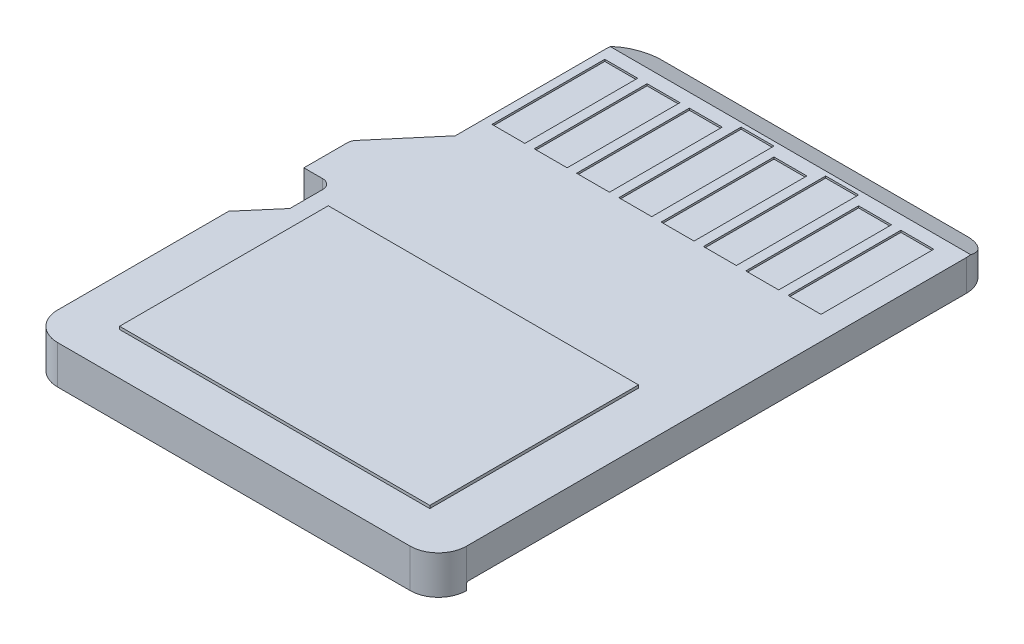
from build123d import *

# Parameters (mm, degrees)
BOSS_EXTRUDE1_DEPTH = 9.753600003
SKETCH2_W           = 8.686799997
SKETCH2_H           = 0.8382
BOSS_EXTRUDE2_DEPTH = 1.295399997
BOSS_EXTRUDE3_DEPTH = 0.2032
SKETCH4_W           = 0.762
SKETCH4_H           = 2.032
CUT_EXTRUDE1_DEPTH  = 19.680648463
SKETCH5_W           = 8.382
SKETCH5_H           = 5.6388
BOSS_EXTRUDE4_DEPTH = 0.0762
SKETCH6_W           = 0.889000002
SKETCH6_H           = 3.048
CUT_EXTRUDE2_DEPTH  = 0.0508
SKETCH7_W           = 0.889
SKETCH7_H           = 3.048
CUT_EXTRUDE3_DEPTH  = 0.0508
SKETCH8_W           = 0.889
SKETCH8_H           = 3.048
CUT_EXTRUDE4_DEPTH  = 0.0508
SKETCH9_W           = 0.889
SKETCH9_H           = 3.048
CUT_EXTRUDE5_DEPTH  = 0.0508
SKETCH10_W          = 0.889
SKETCH10_H          = 3.048
CUT_EXTRUDE6_DEPTH  = 0.0508
SKETCH11_W          = 0.888999999
SKETCH11_H          = 3.301999998
CUT_EXTRUDE7_DEPTH  = 0.0508
SKETCH12_W          = 0.888999999
SKETCH12_H          = 3.301999998
CUT_EXTRUDE8_DEPTH  = 0.0508
SKETCH13_W          = 0.889
SKETCH13_H          = 3.048
CUT_EXTRUDE9_DEPTH  = 0.0508
DRAFT1_ANGLE        = 49.398705355
DRAFT2_ANGLE        = 49.635463485
FILLET2_R           = 0.050800005
FILLET3_R           = 0.254
FILLET4_R           = 0.762


with BuildPart() as part:
    # Sketch1 → Boss-Extrude1 (new body)
    with BuildSketch(Plane(origin=(1.2954, 0, 0), x_dir=(0, -1, 0), z_dir=(-1, 0, 0))):
        Polygon((-0.8382, 0), (-0.8382, -14.391699969), (-0.5842, -15.026699969), (0, -15.026699969), (0, 0), align=None)
    extrude(amount=-BOSS_EXTRUDE1_DEPTH)

    # Sketch2 → Boss-Extrude2 (add)
    with BuildSketch(Plane.ZY.offset(-1.2954)):
        with Locations((-4.343399999, 0.4191)):
            Rectangle(SKETCH2_W, SKETCH2_H)
    extrude(amount=BOSS_EXTRUDE2_DEPTH)

    # Sketch3 → Boss-Extrude3 (add)
    with BuildSketch(Plane.XZ):
        with BuildLine():
            Line((0, -0.762000007), (0, 0))
            Line((0, 0), (11.049, 0))
            Line((11.049, 0), (11.049, -0.762000007))
            ThreePointArc((11.049, -0.762000007), (5.5245, -1.709233412), (0, -0.762000007))
        make_face()
    extrude(amount=BOSS_EXTRUDE3_DEPTH)

    # Sketch4 → Cut-Extrude1 (cut, through all)
    with BuildSketch(Plane(origin=(0, 0.8382, 0), x_dir=(-1, 0, 0), z_dir=(0, 1, 0))):
        with Locations((-0.381, -6.4008)):
            Rectangle(SKETCH4_W, SKETCH4_H)
    extrude(amount=-CUT_EXTRUDE1_DEPTH, mode=Mode.SUBTRACT)

    # Sketch5 → Boss-Extrude4 (add)
    with BuildSketch(Plane(origin=(0, 0.8382, 0), x_dir=(-1, 0, 0), z_dir=(0, 1, 0))):
        with Locations((-5.483604679, -3.9624)):
            Rectangle(SKETCH5_W, SKETCH5_H)
    extrude(amount=BOSS_EXTRUDE4_DEPTH)

    # Sketch6 → Cut-Extrude2 (cut)
    with BuildSketch(Plane(origin=(0, 0.8382, 0), x_dir=(-1, 0, 0), z_dir=(0, 1, 0))):
        with Locations((-1.9685, -12.496800003)):
            Rectangle(SKETCH6_W, SKETCH6_H)
    extrude(amount=-CUT_EXTRUDE2_DEPTH, mode=Mode.SUBTRACT)

    # Sketch7 → Cut-Extrude3 (cut)
    with BuildSketch(Plane(origin=(0, 0.8382, 0), x_dir=(-1, 0, 0), z_dir=(0, 1, 0))):
        with Locations((-4.254499999, -12.496800003)):
            Rectangle(SKETCH7_W, SKETCH7_H)
    extrude(amount=-CUT_EXTRUDE3_DEPTH, mode=Mode.SUBTRACT)

    # Sketch8 → Cut-Extrude4 (cut)
    with BuildSketch(Plane(origin=(0, 0.8382, 0), x_dir=(-1, 0, 0), z_dir=(0, 1, 0))):
        with Locations((-3.111499999, -12.496800003)):
            Rectangle(SKETCH8_W, SKETCH8_H)
    extrude(amount=-CUT_EXTRUDE4_DEPTH, mode=Mode.SUBTRACT)

    # Sketch9 → Cut-Extrude5 (cut)
    with BuildSketch(Plane(origin=(0, 0.8382, 0), x_dir=(-1, 0, 0), z_dir=(0, 1, 0))):
        with Locations((-9.969500001, -12.496800003)):
            Rectangle(SKETCH9_W, SKETCH9_H)
    extrude(amount=-CUT_EXTRUDE5_DEPTH, mode=Mode.SUBTRACT)

    # Sketch10 → Cut-Extrude6 (cut)
    with BuildSketch(Plane(origin=(0, 0.8382, 0), x_dir=(-1, 0, 0), z_dir=(0, 1, 0))):
        with Locations((-6.5405, -12.496800003)):
            Rectangle(SKETCH10_W, SKETCH10_H)
    extrude(amount=-CUT_EXTRUDE6_DEPTH, mode=Mode.SUBTRACT)

    # Sketch11 → Cut-Extrude7 (cut)
    with BuildSketch(Plane(origin=(0, 0.8382, 0), x_dir=(-1, 0, 0), z_dir=(0, 1, 0))):
        with Locations((-5.3975, -12.623800002)):
            Rectangle(SKETCH11_W, SKETCH11_H)
    extrude(amount=-CUT_EXTRUDE7_DEPTH, mode=Mode.SUBTRACT)

    # Sketch12 → Cut-Extrude8 (cut)
    with BuildSketch(Plane(origin=(0, 0.8382, 0), x_dir=(-1, 0, 0), z_dir=(0, 1, 0))):
        with Locations((-7.683500001, -12.623800002)):
            Rectangle(SKETCH12_W, SKETCH12_H)
    extrude(amount=-CUT_EXTRUDE8_DEPTH, mode=Mode.SUBTRACT)

    # Sketch13 → Cut-Extrude9 (cut)
    with BuildSketch(Plane(origin=(0, 0.8382, 0), x_dir=(-1, 0, 0), z_dir=(0, 1, 0))):
        with Locations((-8.826500001, -12.496800003)):
            Rectangle(SKETCH13_W, SKETCH13_H)
    extrude(amount=-CUT_EXTRUDE9_DEPTH, mode=Mode.SUBTRACT)

    # Draft1
    draft1_faces = [part.faces().sort_by_distance(p)[0] for p in [
        (0.381, 0.4191, -5.3848),
    ]]
    draft(draft1_faces, Plane(origin=(3e-09, 0, 0), x_dir=(0, 0, -1), z_dir=(-1, 0, 0)), DRAFT1_ANGLE)

    # Draft2
    draft2_faces = [part.faces().sort_by_distance(p)[0] for p in [
        (0.647700002, 0.4191, -8.686799997),
    ]]
    draft(draft2_faces, Plane(origin=(3e-09, 0, 0), x_dir=(0, 0, -1), z_dir=(-1, 0, 0)), DRAFT2_ANGLE)

    # Fillet2
    fillet2_edges = [part.edges().sort_by_distance(p)[0] for p in [
        (5.5245, 0, -1.709233412),
    ]]
    fillet(fillet2_edges, radius=FILLET2_R)

    # Fillet3
    fillet3_edges = [part.edges().sort_by_distance(p)[0] for p in [
        (3e-09, 0.4191, -8.686799997),
        (0.762, 0.4191, -7.4168),
    ]]
    fillet(fillet3_edges, radius=FILLET3_R)

    # Fillet4
    fillet4_edges = [part.edges().sort_by_distance(p)[0] for p in [
        (3e-09, 0.4191, 0),
        (11.049000003, 0.2921, -15.026699969),
        (11.049000003, 0.4191, 0),
        (1.2954, 0.2921, -15.026699969),
    ]]
    fillet(fillet4_edges, radius=FILLET4_R)


solid = part.part
